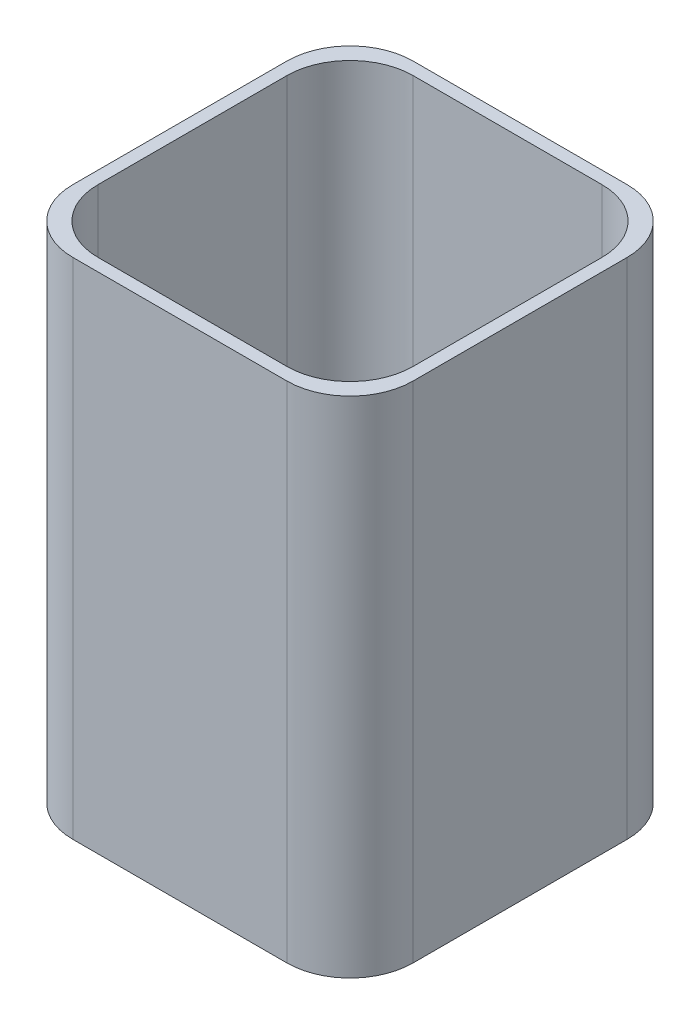
from build123d import *

# Parameters (mm, degrees)
SKETCH2_W           = 54
SKETCH2_H           = 54
BOSS_EXTRUDE1_DEPTH = 80
SKETCH3_W           = 50
SKETCH3_H           = 50
CUT_EXTRUDE1_DEPTH  = 78
FILLET2_R           = 10
FILLET3_R           = 10


with BuildPart() as part:
    # Sketch2 → Boss-Extrude1 (new body)
    with BuildSketch(Plane(origin=(0, 0, 0), x_dir=(1, 0, 0), z_dir=(0, 1, 0))):
        with Locations((-53.331532102, 19.445132848)):
            Rectangle(SKETCH2_W, SKETCH2_H)
    extrude(amount=BOSS_EXTRUDE1_DEPTH)

    # Sketch3 → Cut-Extrude1 (cut)
    with BuildSketch(Plane(origin=(0, 80, 0), x_dir=(1, 0, 0), z_dir=(0, 1, 0))):
        with Locations((-53.331532102, 19.445132848)):
            Rectangle(SKETCH3_W, SKETCH3_H)
    extrude(amount=-CUT_EXTRUDE1_DEPTH, mode=Mode.SUBTRACT)

    # Fillet2
    fillet2_edges = [part.edges().sort_by_distance(p)[0] for p in [
        (-78.331532102, 41, 5.554867152),
        (-78.331532102, 41, -44.445132848),
        (-28.331532102, 41, -44.445132848),
        (-28.331532102, 41, 5.554867152),
    ]]
    fillet(fillet2_edges, radius=FILLET2_R)

    # Fillet3
    fillet3_edges = [part.edges().sort_by_distance(p)[0] for p in [
        (-80.331532102, 40, -46.445132848),
        (-26.331532102, 40, -46.445132848),
        (-26.331532102, 40, 7.554867152),
        (-80.331532102, 40, 7.554867152),
    ]]
    fillet(fillet3_edges, radius=FILLET3_R)


solid = part.part
